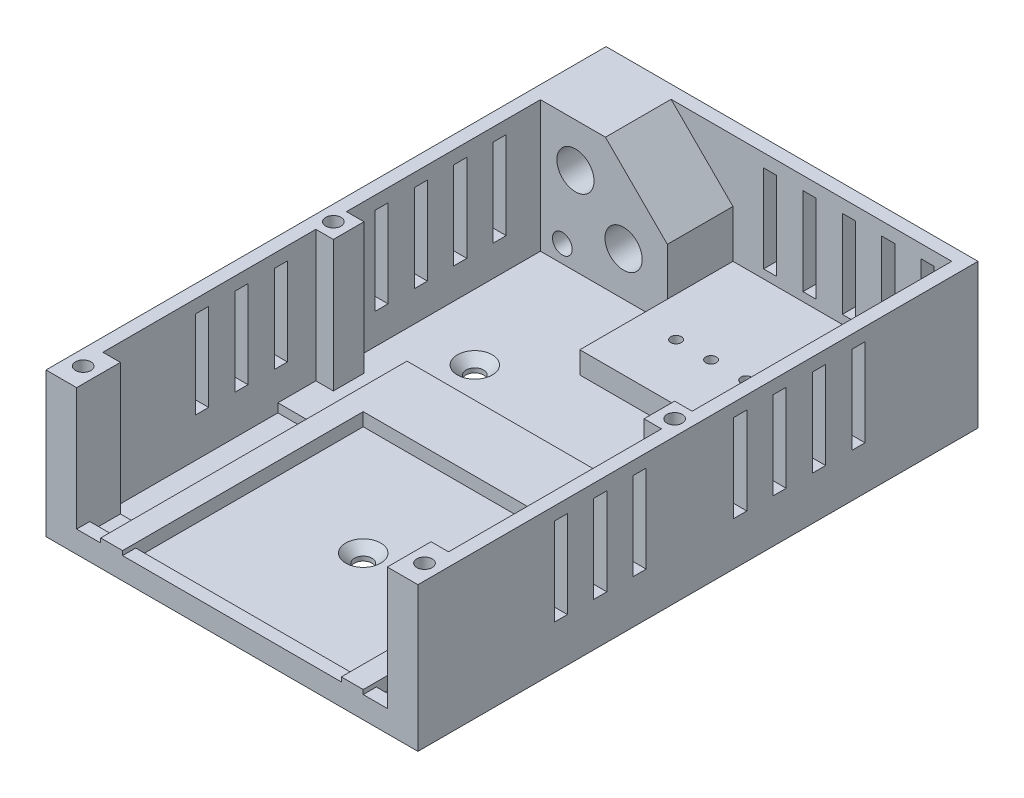
from build123d import *

# Parameters (mm, degrees)
SKETCH2_W                       = 79
SKETCH2_H                       = 125
BOSS_EXTRUDE1_DEPTH             = 3
SKETCH3_W                       = 60
SKETCH3_H                       = 70
SUPPORT_DEPTH                   = 3
SKETCH4_W                       = 50
SKETCH4_H                       = 55
REMOVE_PLASTIC_DEPTH            = 3
SKETCH5_W                       = 50
SKETCH5_H                       = 35
BOSS_EXTRUDE3_DEPTH             = 5
SKETCH6_R                       = 1.2
CUT_EXTRUDE2_DEPTH              = 5
CUT_EXTRUDE2_DRAFT              = -1
CUT_EXTRUDE2_PROFILE_2_DEPTH    = 5
CUT_EXTRUDE2_PROFILE_2_DRAFT    = -1
CUT_EXTRUDE2_PROFILE_3_DEPTH    = 5
CUT_EXTRUDE2_PROFILE_3_DRAFT    = -1
CUT_EXTRUDE2_PROFILE_4_DEPTH    = 5
CUT_EXTRUDE2_PROFILE_4_DRAFT    = -1
CUT_EXTRUDE2_PROFILE_5_DEPTH    = 5
CUT_EXTRUDE2_PROFILE_5_DRAFT    = -1
SKETCH7_W                       = 29
SKETCH7_H                       = 15
CABLE_BLOCK_DEPTH               = 30
WALLS_DEPTH                     = 33
SKETCH8_R                       = 4.25
SKETCH8_R_2                     = 2.25
CABLE_HOLES_ROUND_DEPTH         = 31
SKETCH10_W                      = 4
SKETCH10_H                      = 10
LID_SCREW_POSTS_FRONT_DEPTH     = 30
REMOVE_MATERIAL_DEPTH           = 15
SKETCH13_W                      = 4
SKETCH13_H                      = 7
LID_SCREW_POSTS_BACK_DEPTH      = 30
SKETCH14_R                      = 1.75
LID_SCREW_HOLES_DEPTH           = 20
LID_SCREW_HOLES_DRAFT           = -1
LID_SCREW_HOLES_PROFILE_2_DEPTH = 20
LID_SCREW_HOLES_PROFILE_2_DRAFT = -1
LID_SCREW_HOLES_PROFILE_3_DEPTH = 20
LID_SCREW_HOLES_PROFILE_3_DRAFT = -1
LID_SCREW_HOLES_PROFILE_4_DEPTH = 20
LID_SCREW_HOLES_PROFILE_4_DRAFT = -1
SKETCH16_W                      = 9.5
SKETCH16_H                      = 40
SLIDERS_DEPTH                   = 2
SKETCH17_W                      = 71
SKETCH17_H                      = 2
FRONT_LIP_DEPTH                 = 3
VENTS_SIDES_REACH               = 114.269
SKETCH19_W                      = 3
SKETCH19_H                      = 20
SKETCH22_W                      = 3
SKETCH22_H                      = 20
VENTS_BACK_DEPTH                = 3
SKETCH20_R                      = 2
CUT_EXTRUDE4_DEPTH              = 3
SKETCH21_R                      = 4
CUT_EXTRUDE5_DEPTH              = 3
CUT_EXTRUDE5_DRAFT              = -45
CUT_EXTRUDE5_PROFILE_2_DEPTH    = 3
CUT_EXTRUDE5_PROFILE_2_DRAFT    = -45
CUT_EXTRUDE5_PROFILE_3_DEPTH    = 3
CUT_EXTRUDE5_PROFILE_3_DRAFT    = -45


with BuildPart() as part:
    # Sketch2 → Boss-Extrude1 (new body)
    with BuildSketch(Plane(origin=(0, 0, 0), x_dir=(1, 0, 0), z_dir=(0, 1, 0))):
        Rectangle(SKETCH2_W, SKETCH2_H)
    extrude(amount=BOSS_EXTRUDE1_DEPTH)

    # Sketch3 → support (add)
    with BuildSketch(Plane(origin=(0, 3, 0), x_dir=(1, 0, 0), z_dir=(0, 1, 0))):
        with Locations((0, -27.5)):
            Rectangle(SKETCH3_W, SKETCH3_H)
    extrude(amount=SUPPORT_DEPTH)

    # Sketch4 → remove plastic (cut)
    with BuildSketch(Plane(origin=(0, 6, 0), x_dir=(1, 0, 0), z_dir=(0, 1, 0))):
        with Locations((0, -35)):
            Rectangle(SKETCH4_W, SKETCH4_H)
    extrude(amount=-REMOVE_PLASTIC_DEPTH, mode=Mode.SUBTRACT)

    # Sketch5 → Boss-Extrude3 (add)
    with BuildSketch(Plane(origin=(0, 3, 0), x_dir=(1, 0, 0), z_dir=(0, 1, 0))):
        with Locations((14.5, 45)):
            Rectangle(SKETCH5_W, SKETCH5_H)
    extrude(amount=BOSS_EXTRUDE3_DEPTH)


with BuildPart() as cut_extrude2_tool:
    # Sketch6 → Cut-Extrude2 (with draft: the straight prism first)
    with BuildSketch(Plane(origin=(0, 8, 0), x_dir=(1, 0, 0), z_dir=(0, 1, 0))):
        with Locations((-1.5, 40.5)):
            Circle(SKETCH6_R)
    extrude(amount=-CUT_EXTRUDE2_DEPTH)
    # Cut-Extrude2: the draft: its side faces are tilted about the plane it starts from
    cut_extrude2_sides = [cut_extrude2_tool.faces().sort_by_distance(p)[0] for p in [
        (-2.7, 5.5, -40.5),
    ]]
    draft(cut_extrude2_sides, Plane(origin=(0, 8, 0), x_dir=(1, 0, 0), z_dir=(0, 1, 0)), CUT_EXTRUDE2_DRAFT)


with BuildPart() as part_1:
    add(part.part)

    # Cut-Extrude2: cut by cut_extrude2_tool
    add(cut_extrude2_tool.part, mode=Mode.SUBTRACT)


with BuildPart() as cut_extrude2_profile_2_tool:
    # Sketch6 → Cut-Extrude2 profile 2 (with draft: the straight prism first)
    with BuildSketch(Plane(origin=(0, 8, 0), x_dir=(1, 0, 0), z_dir=(0, 1, 0))):
        with Locations((6.5, 40.5)):
            Circle(SKETCH6_R)
    extrude(amount=-CUT_EXTRUDE2_PROFILE_2_DEPTH)
    # Cut-Extrude2 profile 2: the draft: its side faces are tilted about the plane it starts from
    cut_extrude2_profile_2_sides = [cut_extrude2_profile_2_tool.faces().sort_by_distance(p)[0] for p in [
        (5.3, 5.5, -40.5),
    ]]
    draft(cut_extrude2_profile_2_sides, Plane(origin=(0, 8, 0), x_dir=(1, 0, 0), z_dir=(0, 1, 0)), CUT_EXTRUDE2_PROFILE_2_DRAFT)


with BuildPart() as part_2:
    add(part_1.part)

    # Cut-Extrude2 profile 2: cut by cut_extrude2_profile_2_tool
    add(cut_extrude2_profile_2_tool.part, mode=Mode.SUBTRACT)


with BuildPart() as cut_extrude2_profile_3_tool:
    # Sketch6 → Cut-Extrude2 profile 3 (with draft: the straight prism first)
    with BuildSketch(Plane(origin=(0, 8, 0), x_dir=(1, 0, 0), z_dir=(0, 1, 0))):
        with Locations((14.5, 40.5)):
            Circle(SKETCH6_R)
    extrude(amount=-CUT_EXTRUDE2_PROFILE_3_DEPTH)
    # Cut-Extrude2 profile 3: the draft: its side faces are tilted about the plane it starts from
    cut_extrude2_profile_3_sides = [cut_extrude2_profile_3_tool.faces().sort_by_distance(p)[0] for p in [
        (13.3, 5.5, -40.5),
    ]]
    draft(cut_extrude2_profile_3_sides, Plane(origin=(0, 8, 0), x_dir=(1, 0, 0), z_dir=(0, 1, 0)), CUT_EXTRUDE2_PROFILE_3_DRAFT)


with BuildPart() as part_3:
    add(part_2.part)

    # Cut-Extrude2 profile 3: cut by cut_extrude2_profile_3_tool
    add(cut_extrude2_profile_3_tool.part, mode=Mode.SUBTRACT)


with BuildPart() as cut_extrude2_profile_4_tool:
    # Sketch6 → Cut-Extrude2 profile 4 (with draft: the straight prism first)
    with BuildSketch(Plane(origin=(0, 8, 0), x_dir=(1, 0, 0), z_dir=(0, 1, 0))):
        with Locations((22.5, 40.5)):
            Circle(SKETCH6_R)
    extrude(amount=-CUT_EXTRUDE2_PROFILE_4_DEPTH)
    # Cut-Extrude2 profile 4: the draft: its side faces are tilted about the plane it starts from
    cut_extrude2_profile_4_sides = [cut_extrude2_profile_4_tool.faces().sort_by_distance(p)[0] for p in [
        (21.3, 5.5, -40.5),
    ]]
    draft(cut_extrude2_profile_4_sides, Plane(origin=(0, 8, 0), x_dir=(1, 0, 0), z_dir=(0, 1, 0)), CUT_EXTRUDE2_PROFILE_4_DRAFT)


with BuildPart() as part_4:
    add(part_3.part)

    # Cut-Extrude2 profile 4: cut by cut_extrude2_profile_4_tool
    add(cut_extrude2_profile_4_tool.part, mode=Mode.SUBTRACT)


with BuildPart() as cut_extrude2_profile_5_tool:
    # Sketch6 → Cut-Extrude2 profile 5 (with draft: the straight prism first)
    with BuildSketch(Plane(origin=(0, 8, 0), x_dir=(1, 0, 0), z_dir=(0, 1, 0))):
        with Locations((30.5, 40.5)):
            Circle(SKETCH6_R)
    extrude(amount=-CUT_EXTRUDE2_PROFILE_5_DEPTH)
    # Cut-Extrude2 profile 5: the draft: its side faces are tilted about the plane it starts from
    cut_extrude2_profile_5_sides = [cut_extrude2_profile_5_tool.faces().sort_by_distance(p)[0] for p in [
        (29.3, 5.5, -40.5),
    ]]
    draft(cut_extrude2_profile_5_sides, Plane(origin=(0, 8, 0), x_dir=(1, 0, 0), z_dir=(0, 1, 0)), CUT_EXTRUDE2_PROFILE_5_DRAFT)


with BuildPart() as part_5:
    add(part_4.part)

    # Cut-Extrude2 profile 5: cut by cut_extrude2_profile_5_tool
    add(cut_extrude2_profile_5_tool.part, mode=Mode.SUBTRACT)

    # Sketch7 → cable block (add)
    with BuildSketch(Plane(origin=(0, 3, 0), x_dir=(1, 0, 0), z_dir=(0, 1, 0))):
        with Locations((-25, 55)):
            Rectangle(SKETCH7_W, SKETCH7_H)
    extrude(amount=CABLE_BLOCK_DEPTH)

    # Sketch9 → walls (add)
    with BuildSketch(Plane(origin=(0, 0, 0), x_dir=(1, 0, 0), z_dir=(0, 1, 0))):
        Polygon((-39.5, 62.5), (-39.5, -62.5), (-42.5, -62.5), (-42.5, 65.5), (42.5, 65.5), (42.5, -62.5), (39.5, -62.5), (39.5, 62.5), align=None)
    extrude(amount=WALLS_DEPTH)

    # Sketch8 → cable holes round (cut)
    with BuildSketch(Plane.XY.offset(-47.5)):
        with Locations((-20.5, 13)):
            Circle(SKETCH8_R)
        with Locations((-34.5, 7)):
            Circle(SKETCH8_R_2)
        with Locations((-31.5, 23)):
            Circle(SKETCH8_R)
    extrude(amount=-CABLE_HOLES_ROUND_DEPTH, mode=Mode.SUBTRACT)

    # Sketch10 → Lid screw posts front (add)
    with BuildSketch(Plane(origin=(0, 3, 0), x_dir=(1, 0, 0), z_dir=(0, 1, 0))):
        with Locations((-37.5, -57.5)):
            Rectangle(SKETCH10_W, SKETCH10_H)
        with Locations((37.5, -57.5)):
            Rectangle(SKETCH10_W, SKETCH10_H)
    extrude(amount=LID_SCREW_POSTS_FRONT_DEPTH)

    # Sketch12 → remove Material (cut)
    with BuildSketch(Plane.XY.offset(-47.5)):
        Polygon((-24.642135624, 33), (-10.5, 18.857864376), (-10.5, 33), align=None)
    extrude(amount=-REMOVE_MATERIAL_DEPTH, mode=Mode.SUBTRACT)

    # Sketch13 → Lid screw posts back (add)
    with BuildSketch(Plane(origin=(0, 3, 0), x_dir=(1, 0, 0), z_dir=(0, 1, 0))):
        with Locations((-37.5, -0.330127019)):
            Rectangle(SKETCH13_W, SKETCH13_H)
        with Locations((37.5, -0.330127019)):
            Rectangle(SKETCH13_W, SKETCH13_H)
    extrude(amount=LID_SCREW_POSTS_BACK_DEPTH)


with BuildPart() as lid_screw_holes_tool:
    # Sketch14 → Lid screw holes (with draft: the straight prism first)
    with BuildSketch(Plane(origin=(0, 33, 0), x_dir=(1, 0, 0), z_dir=(0, 1, 0))):
        with Locations((-39, -57.5)):
            Circle(SKETCH14_R)
    extrude(amount=-LID_SCREW_HOLES_DEPTH)
    # Lid screw holes: the draft: its side faces are tilted about the plane it starts from
    lid_screw_holes_sides = [lid_screw_holes_tool.faces().sort_by_distance(p)[0] for p in [
        (-40.75, 23, 57.5),
    ]]
    draft(lid_screw_holes_sides, Plane(origin=(0, 33, 0), x_dir=(1, 0, 0), z_dir=(0, 1, 0)), LID_SCREW_HOLES_DRAFT)


with BuildPart() as part_6:
    add(part_5.part)

    # Lid screw holes: cut by lid_screw_holes_tool
    add(lid_screw_holes_tool.part, mode=Mode.SUBTRACT)


with BuildPart() as lid_screw_holes_profile_2_tool:
    # Sketch14 → Lid screw holes profile 2 (with draft: the straight prism first)
    with BuildSketch(Plane(origin=(0, 33, 0), x_dir=(1, 0, 0), z_dir=(0, 1, 0))):
        with Locations((39, -57.5)):
            Circle(SKETCH14_R)
    extrude(amount=-LID_SCREW_HOLES_PROFILE_2_DEPTH)
    # Lid screw holes profile 2: the draft: its side faces are tilted about the plane it starts from
    lid_screw_holes_profile_2_sides = [lid_screw_holes_profile_2_tool.faces().sort_by_distance(p)[0] for p in [
        (37.25, 23, 57.5),
    ]]
    draft(lid_screw_holes_profile_2_sides, Plane(origin=(0, 33, 0), x_dir=(1, 0, 0), z_dir=(0, 1, 0)), LID_SCREW_HOLES_PROFILE_2_DRAFT)


with BuildPart() as part_7:
    add(part_6.part)

    # Lid screw holes profile 2: cut by lid_screw_holes_profile_2_tool
    add(lid_screw_holes_profile_2_tool.part, mode=Mode.SUBTRACT)


with BuildPart() as lid_screw_holes_profile_3_tool:
    # Sketch14 → Lid screw holes profile 3 (with draft: the straight prism first)
    with BuildSketch(Plane(origin=(0, 33, 0), x_dir=(1, 0, 0), z_dir=(0, 1, 0))):
        with Locations((39, -0.330127019)):
            Circle(SKETCH14_R)
    extrude(amount=-LID_SCREW_HOLES_PROFILE_3_DEPTH)
    # Lid screw holes profile 3: the draft: its side faces are tilted about the plane it starts from
    lid_screw_holes_profile_3_sides = [lid_screw_holes_profile_3_tool.faces().sort_by_distance(p)[0] for p in [
        (37.25, 23, 0.330127019),
    ]]
    draft(lid_screw_holes_profile_3_sides, Plane(origin=(0, 33, 0), x_dir=(1, 0, 0), z_dir=(0, 1, 0)), LID_SCREW_HOLES_PROFILE_3_DRAFT)


with BuildPart() as part_8:
    add(part_7.part)

    # Lid screw holes profile 3: cut by lid_screw_holes_profile_3_tool
    add(lid_screw_holes_profile_3_tool.part, mode=Mode.SUBTRACT)


with BuildPart() as lid_screw_holes_profile_4_tool:
    # Sketch14 → Lid screw holes profile 4 (with draft: the straight prism first)
    with BuildSketch(Plane(origin=(0, 33, 0), x_dir=(1, 0, 0), z_dir=(0, 1, 0))):
        with Locations((-39, -0.330127019)):
            Circle(SKETCH14_R)
    extrude(amount=-LID_SCREW_HOLES_PROFILE_4_DEPTH)
    # Lid screw holes profile 4: the draft: its side faces are tilted about the plane it starts from
    lid_screw_holes_profile_4_sides = [lid_screw_holes_profile_4_tool.faces().sort_by_distance(p)[0] for p in [
        (-40.75, 23, 0.330127019),
    ]]
    draft(lid_screw_holes_profile_4_sides, Plane(origin=(0, 33, 0), x_dir=(1, 0, 0), z_dir=(0, 1, 0)), LID_SCREW_HOLES_PROFILE_4_DRAFT)


with BuildPart() as part_9:
    add(part_8.part)

    # Lid screw holes profile 4: cut by lid_screw_holes_profile_4_tool
    add(lid_screw_holes_profile_4_tool.part, mode=Mode.SUBTRACT)

    # Sketch16 → Sliders (cut)
    with BuildSketch(Plane(origin=(0, 3, 0), x_dir=(1, 0, 0), z_dir=(0, 1, 0))):
        with Locations((-34.75, -32.5)):
            Rectangle(SKETCH16_W, SKETCH16_H)
        with Locations((34.75, -32.5)):
            Rectangle(SKETCH16_W, SKETCH16_H)
    extrude(amount=-SLIDERS_DEPTH, mode=Mode.SUBTRACT)

    # Sketch17 → Front Lip (add)
    with BuildSketch(Plane.XY.offset(62.5)):
        with Locations((0, 4)):
            Rectangle(SKETCH17_W, SKETCH17_H)
    extrude(amount=-FRONT_LIP_DEPTH)

    # Vents Sides: up to this face of the body (flat: up to its plane)
    vents_sides_end = Plane(part_9.part.faces().sort_by_distance((-42.5, 16.5, -1.5))[0])
    # Sketch19 → Vents Sides (cut, up to the picked face)
    with BuildSketch(Plane(origin=(42.5, 0, 0), x_dir=(0, 0, -1), z_dir=(1, 0, 0)), mode=Mode.PRIVATE) as vents_sides_sk1:
        with Locations((38.17, 20)):
            Rectangle(SKETCH19_W, SKETCH19_H)
    vents_sides_tool1 = split(extrude(vents_sides_sk1.sketch, amount=-VENTS_SIDES_REACH, mode=Mode.PRIVATE), bisect_by=vents_sides_end, keep=Keep.BOTH, mode=Mode.PRIVATE)
    # Sketch19 → Vents Sides (cut, up to the picked face)
    with BuildSketch(Plane(origin=(42.5, 0, 0), x_dir=(0, 0, -1), z_dir=(1, 0, 0)), mode=Mode.PRIVATE) as vents_sides_sk2:
        with Locations((29.17, 20)):
            Rectangle(SKETCH19_W, SKETCH19_H)
    vents_sides_tool2 = split(extrude(vents_sides_sk2.sketch, amount=-VENTS_SIDES_REACH, mode=Mode.PRIVATE), bisect_by=vents_sides_end, keep=Keep.BOTH, mode=Mode.PRIVATE)
    # Sketch19 → Vents Sides (cut, up to the picked face)
    with BuildSketch(Plane(origin=(42.5, 0, 0), x_dir=(0, 0, -1), z_dir=(1, 0, 0)), mode=Mode.PRIVATE) as vents_sides_sk3:
        with Locations((20.17, 20)):
            Rectangle(SKETCH19_W, SKETCH19_H)
    vents_sides_tool3 = split(extrude(vents_sides_sk3.sketch, amount=-VENTS_SIDES_REACH, mode=Mode.PRIVATE), bisect_by=vents_sides_end, keep=Keep.BOTH, mode=Mode.PRIVATE)
    # Sketch19 → Vents Sides (cut, up to the picked face)
    with BuildSketch(Plane(origin=(42.5, 0, 0), x_dir=(0, 0, -1), z_dir=(1, 0, 0)), mode=Mode.PRIVATE) as vents_sides_sk4:
        with Locations((11.17, 20)):
            Rectangle(SKETCH19_W, SKETCH19_H)
    vents_sides_tool4 = split(extrude(vents_sides_sk4.sketch, amount=-VENTS_SIDES_REACH, mode=Mode.PRIVATE), bisect_by=vents_sides_end, keep=Keep.BOTH, mode=Mode.PRIVATE)
    # Sketch19 → Vents Sides (cut, up to the picked face)
    with BuildSketch(Plane(origin=(42.5, 0, 0), x_dir=(0, 0, -1), z_dir=(1, 0, 0)), mode=Mode.PRIVATE) as vents_sides_sk5:
        with Locations((-11.83, 20)):
            Rectangle(SKETCH19_W, SKETCH19_H)
    vents_sides_tool5 = split(extrude(vents_sides_sk5.sketch, amount=-VENTS_SIDES_REACH, mode=Mode.PRIVATE), bisect_by=vents_sides_end, keep=Keep.BOTH, mode=Mode.PRIVATE)
    # Sketch19 → Vents Sides (cut, up to the picked face)
    with BuildSketch(Plane(origin=(42.5, 0, 0), x_dir=(0, 0, -1), z_dir=(1, 0, 0)), mode=Mode.PRIVATE) as vents_sides_sk6:
        with Locations((-20.83, 20)):
            Rectangle(SKETCH19_W, SKETCH19_H)
    vents_sides_tool6 = split(extrude(vents_sides_sk6.sketch, amount=-VENTS_SIDES_REACH, mode=Mode.PRIVATE), bisect_by=vents_sides_end, keep=Keep.BOTH, mode=Mode.PRIVATE)
    # Sketch19 → Vents Sides (cut, up to the picked face)
    with BuildSketch(Plane(origin=(42.5, 0, 0), x_dir=(0, 0, -1), z_dir=(1, 0, 0)), mode=Mode.PRIVATE) as vents_sides_sk7:
        with Locations((-29.83, 20)):
            Rectangle(SKETCH19_W, SKETCH19_H)
    vents_sides_tool7 = split(extrude(vents_sides_sk7.sketch, amount=-VENTS_SIDES_REACH, mode=Mode.PRIVATE), bisect_by=vents_sides_end, keep=Keep.BOTH, mode=Mode.PRIVATE)
    add(vents_sides_tool1.solids().sort_by(Axis((42.5, 20, -38.17), (-1, 0, 0)))[0], mode=Mode.SUBTRACT)
    add(vents_sides_tool2.solids().sort_by(Axis((42.5, 20, -29.17), (-1, 0, 0)))[0], mode=Mode.SUBTRACT)
    add(vents_sides_tool3.solids().sort_by(Axis((42.5, 20, -20.17), (-1, 0, 0)))[0], mode=Mode.SUBTRACT)
    add(vents_sides_tool4.solids().sort_by(Axis((42.5, 20, -11.17), (-1, 0, 0)))[0], mode=Mode.SUBTRACT)
    add(vents_sides_tool5.solids().sort_by(Axis((42.5, 20, 11.83), (-1, 0, 0)))[0], mode=Mode.SUBTRACT)
    add(vents_sides_tool6.solids().sort_by(Axis((42.5, 20, 20.83), (-1, 0, 0)))[0], mode=Mode.SUBTRACT)
    add(vents_sides_tool7.solids().sort_by(Axis((42.5, 20, 29.83), (-1, 0, 0)))[0], mode=Mode.SUBTRACT)

    # Sketch22 → Vents Back (cut)
    with BuildSketch(Plane(origin=(0, 0, -65.5), x_dir=(-1, 0, 0), z_dir=(0, 0, -1))):
        with Locations((-34, 20)):
            Rectangle(SKETCH22_W, SKETCH22_H)
        with Locations((-7, 20)):
            Rectangle(SKETCH22_W, SKETCH22_H)
        with Locations((-25, 20)):
            Rectangle(SKETCH22_W, SKETCH22_H)
        with Locations((-16, 20)):
            Rectangle(SKETCH22_W, SKETCH22_H)
        with Locations((2, 20)):
            Rectangle(SKETCH22_W, SKETCH22_H)
    extrude(amount=-VENTS_BACK_DEPTH, mode=Mode.SUBTRACT)

    # Sketch20 → Cut-Extrude4 (cut)
    with BuildSketch(Plane(origin=(0, 3, 0), x_dir=(1, 0, 0), z_dir=(0, 1, 0))):
        with Locations(Location((0, -32.5, 0), (0, 0, 270))):
            Circle(SKETCH20_R)
        with Locations(Location((-24.5, 17.5, 0), (0, 0, 270))):
            Circle(SKETCH20_R)
        with Locations(Location((24.5, 17.5, 0), (0, 0, 270))):
            Circle(SKETCH20_R)
    extrude(amount=-CUT_EXTRUDE4_DEPTH, mode=Mode.SUBTRACT)


with BuildPart() as cut_extrude5_tool:
    # Sketch21 → Cut-Extrude5 (with draft: the straight prism first)
    with BuildSketch(Plane(origin=(0, 3, 0), x_dir=(1, 0, 0), z_dir=(0, 1, 0))):
        with Locations((-24.5, 17.5)):
            Circle(SKETCH21_R)
    extrude(amount=-CUT_EXTRUDE5_DEPTH)
    # Cut-Extrude5: the draft: its side faces are tilted about the plane it starts from
    cut_extrude5_sides = [cut_extrude5_tool.faces().sort_by_distance(p)[0] for p in [
        (-28.5, 1.5, -17.5),
    ]]
    draft(cut_extrude5_sides, Plane(origin=(0, 3, 0), x_dir=(1, 0, 0), z_dir=(0, 1, 0)), CUT_EXTRUDE5_DRAFT)


with BuildPart() as part_10:
    add(part_9.part)

    # Cut-Extrude5: cut by cut_extrude5_tool
    add(cut_extrude5_tool.part, mode=Mode.SUBTRACT)


with BuildPart() as cut_extrude5_profile_2_tool:
    # Sketch21 → Cut-Extrude5 profile 2 (with draft: the straight prism first)
    with BuildSketch(Plane(origin=(0, 3, 0), x_dir=(1, 0, 0), z_dir=(0, 1, 0))):
        with Locations((0, -32.5)):
            Circle(SKETCH21_R)
    extrude(amount=-CUT_EXTRUDE5_PROFILE_2_DEPTH)
    # Cut-Extrude5 profile 2: the draft: its side faces are tilted about the plane it starts from
    cut_extrude5_profile_2_sides = [cut_extrude5_profile_2_tool.faces().sort_by_distance(p)[0] for p in [
        (-4, 1.5, 32.5),
    ]]
    draft(cut_extrude5_profile_2_sides, Plane(origin=(0, 3, 0), x_dir=(1, 0, 0), z_dir=(0, 1, 0)), CUT_EXTRUDE5_PROFILE_2_DRAFT)


with BuildPart() as part_11:
    add(part_10.part)

    # Cut-Extrude5 profile 2: cut by cut_extrude5_profile_2_tool
    add(cut_extrude5_profile_2_tool.part, mode=Mode.SUBTRACT)


with BuildPart() as cut_extrude5_profile_3_tool:
    # Sketch21 → Cut-Extrude5 profile 3 (with draft: the straight prism first)
    with BuildSketch(Plane(origin=(0, 3, 0), x_dir=(1, 0, 0), z_dir=(0, 1, 0))):
        with Locations((24.5, 17.5)):
            Circle(SKETCH21_R)
    extrude(amount=-CUT_EXTRUDE5_PROFILE_3_DEPTH)
    # Cut-Extrude5 profile 3: the draft: its side faces are tilted about the plane it starts from
    cut_extrude5_profile_3_sides = [cut_extrude5_profile_3_tool.faces().sort_by_distance(p)[0] for p in [
        (20.5, 1.5, -17.5),
    ]]
    draft(cut_extrude5_profile_3_sides, Plane(origin=(0, 3, 0), x_dir=(1, 0, 0), z_dir=(0, 1, 0)), CUT_EXTRUDE5_PROFILE_3_DRAFT)


with BuildPart() as part_12:
    add(part_11.part)

    # Cut-Extrude5 profile 3: cut by cut_extrude5_profile_3_tool
    add(cut_extrude5_profile_3_tool.part, mode=Mode.SUBTRACT)


solid = part_12.part
